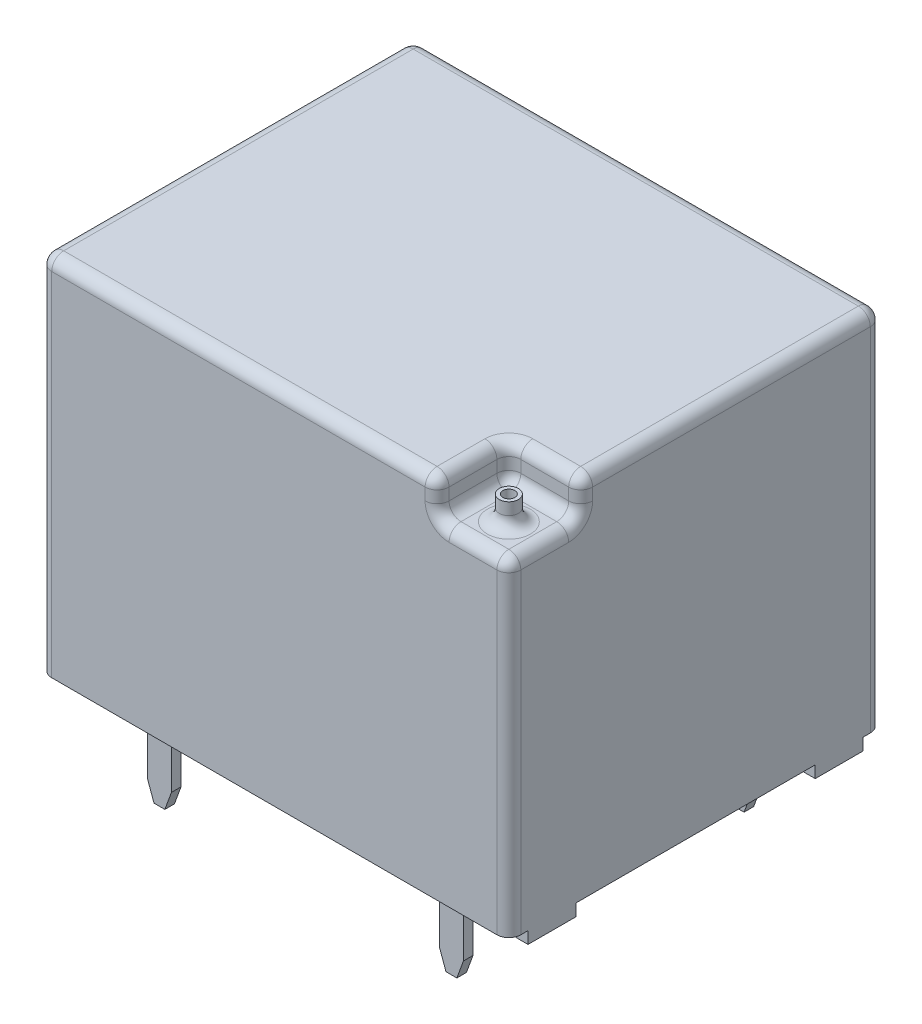
from build123d import *
from OCP.BRepFilletAPI import BRepFilletAPI_MakeChamfer

# Parameters (mm, degrees)
SKETCH_1_W          = 19.6
SKETCH_1_H          = 15.6
EXTRUDE_1_DEPTH     = 15.2
SKETCH_2_W          = 3
SKETCH_2_H          = 3
CUT_EXTRUDE_1_DEPTH = 1.5
SKETCH_3_R          = 0.4
SKETCH_3_R_2        = 0.25
EXTRUDE_2_DEPTH     = 1
SKETCH_5_W          = 0.5
SKETCH_5_H          = 2
EXTRUDE_4_DEPTH     = 0.5
FILLET_1_R          = 0.5
SKETCH_4_W          = 0.25
SKETCH_4_H          = 1.2
SKETCH_4_W_2        = 1
SKETCH_4_H_2        = 0.4
EXTRUDE_3_DEPTH     = 4
CHAMFER_1_SIZE      = 0.75
CHAMFER_1_SIZE2     = 0.272977676


with BuildPart() as part:
    # Эскиз1 → Бобышка-Вытянуть1 (new body)
    with BuildSketch(Plane(origin=(0, 0, 0), x_dir=(1, 0, 0), z_dir=(0, 1, 0))):
        Rectangle(SKETCH_1_W, SKETCH_1_H)
    extrude(amount=EXTRUDE_1_DEPTH)

    # Эскиз2 → Вырез-Вытянуть1 (cut)
    with BuildSketch(Plane(origin=(0, 15.2, 0), x_dir=(1, 0, 0), z_dir=(0, 1, 0))):
        with Locations((8.3, -6.3)):
            Rectangle(SKETCH_2_W, SKETCH_2_H)
    extrude(amount=-CUT_EXTRUDE_1_DEPTH, mode=Mode.SUBTRACT)

    # Эскиз3 → Бобышка-Вытянуть2 (add)
    with BuildSketch(Plane(origin=(0, 13.7, 0), x_dir=(1, 0, 0), z_dir=(0, 1, 0))):
        with Locations(Location((8.3, -6.3, 0), (0, 0, 270))):
            Circle(SKETCH_3_R)
        with Locations(Location((8.3, -6.3, 0), (0, 0, 270))):
            Circle(SKETCH_3_R_2, mode=Mode.SUBTRACT)
    extrude(amount=EXTRUDE_2_DEPTH)

    # Эскиз5 → Бобышка-Вытянуть4 (add)
    with BuildSketch(Plane.XZ):
        with Locations((-9.55, 6)):
            Rectangle(SKETCH_5_W, SKETCH_5_H)
        with Locations((-9.55, -6)):
            Rectangle(SKETCH_5_W, SKETCH_5_H)
        with Locations((9.55, -6)):
            Rectangle(SKETCH_5_W, SKETCH_5_H)
        with Locations((9.55, 6)):
            Rectangle(SKETCH_5_W, SKETCH_5_H)
    extrude(amount=EXTRUDE_4_DEPTH)

    # Скругление1
    fillet_1_edges = [part.edges().sort_by_distance(p)[0] for p in [
        (8.3, 15.2, 4.8),
        (-9.8, 7.6, -7.8),
        (-9.8, 15.2, 0),
        (9.8, 7.6, -7.8),
        (0, 15.2, -7.8),
        (9.8, 15.2, -1.5),
        (8.3, 13.7, 5.9),
        (6.8, 13.7, 6.3),
        (8.3, 13.7, 4.8),
        (9.8, 14.45, 4.8),
        (8.3, 13.7, 7.8),
        (9.8, 13.7, 6.3),
        (6.8, 14.45, 4.8),
        (6.8, 15.2, 6.3),
        (6.8, 14.45, 7.8),
        (-1.5, 15.2, 7.8),
        (9.8, 6.85, 7.8),
        (-9.8, 7.6, 7.8),
    ]]
    fillet(fillet_1_edges, radius=FILLET_1_R)

    # Эскиз4 → Бобышка-Вытянуть3 (add)
    with BuildSketch(Plane.XZ):
        with Locations((-8.4, 0)):
            Rectangle(SKETCH_4_W, SKETCH_4_H)
        with Locations((-6.4, 6)):
            Rectangle(SKETCH_4_W_2, SKETCH_4_H_2)
        with Locations((5.8, 6)):
            Rectangle(SKETCH_4_W_2, SKETCH_4_H_2)
        with Locations((5.8, -6)):
            Rectangle(SKETCH_4_W_2, SKETCH_4_H_2)
        with Locations((-6.4, -6)):
            Rectangle(SKETCH_4_W_2, SKETCH_4_H_2)
    extrude(amount=EXTRUDE_3_DEPTH)

    # Фаска1: one chamfer whose edges measure the first distance from different faces: ONE call of the kernel's chamfer builder (chamfer() names one face for all edges)
    chamfer_1_edges_1 = [part.edges().sort_by_distance(p)[0] for p in [
        (-8.4, -4, 0.6),
    ]]
    chamfer_1_side_1 = [part.faces().sort_by_distance(p)[0] for p in [
        (-8.4, -2, 0.6),
    ]]
    chamfer_1_edges_2 = [part.edges().sort_by_distance(p)[0] for p in [
        (-8.4, -4, -0.6),
    ]]
    chamfer_1_side_2 = [part.faces().sort_by_distance(p)[0] for p in [
        (-8.4, -2, -0.6),
    ]]
    chamfer_1_edges_3 = [part.edges().sort_by_distance(p)[0] for p in [
        (-6.9, -4, 6),
    ]]
    chamfer_1_side_3 = [part.faces().sort_by_distance(p)[0] for p in [
        (-6.9, -2, 6),
    ]]
    chamfer_1_edges_4 = [part.edges().sort_by_distance(p)[0] for p in [
        (-5.9, -4, 6),
    ]]
    chamfer_1_side_4 = [part.faces().sort_by_distance(p)[0] for p in [
        (-5.9, -2, 6),
    ]]
    chamfer_1_edges_5 = [part.edges().sort_by_distance(p)[0] for p in [
        (5.3, -4, 6),
    ]]
    chamfer_1_side_5 = [part.faces().sort_by_distance(p)[0] for p in [
        (5.3, -2, 6),
    ]]
    chamfer_1_edges_6 = [part.edges().sort_by_distance(p)[0] for p in [
        (6.3, -4, 6),
    ]]
    chamfer_1_side_6 = [part.faces().sort_by_distance(p)[0] for p in [
        (6.3, -2, 6),
    ]]
    chamfer_1_edges_7 = [part.edges().sort_by_distance(p)[0] for p in [
        (6.3, -4, -6),
    ]]
    chamfer_1_side_7 = [part.faces().sort_by_distance(p)[0] for p in [
        (6.3, -2, -6),
    ]]
    chamfer_1_edges_8 = [part.edges().sort_by_distance(p)[0] for p in [
        (5.3, -4, -6),
    ]]
    chamfer_1_side_8 = [part.faces().sort_by_distance(p)[0] for p in [
        (5.3, -2, -6),
    ]]
    chamfer_1_edges_9 = [part.edges().sort_by_distance(p)[0] for p in [
        (-5.9, -4, -6),
    ]]
    chamfer_1_side_9 = [part.faces().sort_by_distance(p)[0] for p in [
        (-5.9, -2, -6),
    ]]
    chamfer_1_edges_10 = [part.edges().sort_by_distance(p)[0] for p in [
        (-6.9, -4, -6),
    ]]
    chamfer_1_side_10 = [part.faces().sort_by_distance(p)[0] for p in [
        (-6.9, -2, -6),
    ]]
    chamfer_1 = BRepFilletAPI_MakeChamfer(part.part.solid().wrapped)
    for e in chamfer_1_edges_1:
        chamfer_1.Add(CHAMFER_1_SIZE, CHAMFER_1_SIZE2, e.wrapped, chamfer_1_side_1[0].wrapped)  # the first distance lies on this face
    for e in chamfer_1_edges_2:
        chamfer_1.Add(CHAMFER_1_SIZE, CHAMFER_1_SIZE2, e.wrapped, chamfer_1_side_2[0].wrapped)  # the first distance lies on this face
    for e in chamfer_1_edges_3:
        chamfer_1.Add(CHAMFER_1_SIZE, CHAMFER_1_SIZE2, e.wrapped, chamfer_1_side_3[0].wrapped)  # the first distance lies on this face
    for e in chamfer_1_edges_4:
        chamfer_1.Add(CHAMFER_1_SIZE, CHAMFER_1_SIZE2, e.wrapped, chamfer_1_side_4[0].wrapped)  # the first distance lies on this face
    for e in chamfer_1_edges_5:
        chamfer_1.Add(CHAMFER_1_SIZE, CHAMFER_1_SIZE2, e.wrapped, chamfer_1_side_5[0].wrapped)  # the first distance lies on this face
    for e in chamfer_1_edges_6:
        chamfer_1.Add(CHAMFER_1_SIZE, CHAMFER_1_SIZE2, e.wrapped, chamfer_1_side_6[0].wrapped)  # the first distance lies on this face
    for e in chamfer_1_edges_7:
        chamfer_1.Add(CHAMFER_1_SIZE, CHAMFER_1_SIZE2, e.wrapped, chamfer_1_side_7[0].wrapped)  # the first distance lies on this face
    for e in chamfer_1_edges_8:
        chamfer_1.Add(CHAMFER_1_SIZE, CHAMFER_1_SIZE2, e.wrapped, chamfer_1_side_8[0].wrapped)  # the first distance lies on this face
    for e in chamfer_1_edges_9:
        chamfer_1.Add(CHAMFER_1_SIZE, CHAMFER_1_SIZE2, e.wrapped, chamfer_1_side_9[0].wrapped)  # the first distance lies on this face
    for e in chamfer_1_edges_10:
        chamfer_1.Add(CHAMFER_1_SIZE, CHAMFER_1_SIZE2, e.wrapped, chamfer_1_side_10[0].wrapped)  # the first distance lies on this face
    add(Compound.cast(chamfer_1.Shape()), mode=Mode.REPLACE)


solid = part.part
